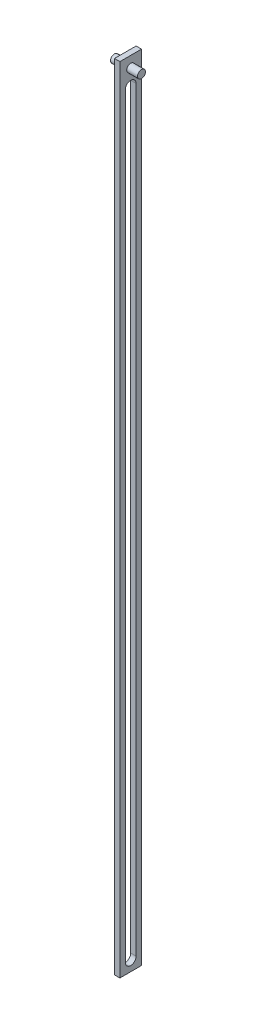
from build123d import *

# Parameters (mm, degrees)
SKETCH1_W                = 12.7
SKETCH1_H                = 457.2
BOSS_EXTRUDE1_DEPTH      = 3.175
SKETCH2_W                = 3.175
SKETCH2_H                = 12.7
BOSS_EXTRUDE2_DEPTH      = 9.525
BOSS_EXTRUDE3_DEPTH      = 6.35
BOSS_EXTRUDE3_DEPTH_BACK = 9.525
SKETCH3_R                = 2.337311212


with BuildPart() as part:
    # Sketch1 → Boss-Extrude1 (new body)
    with BuildSketch(Plane(origin=(0, 0, 0), x_dir=(0, 0, -1), z_dir=(1, 0, 0))):
        with Locations((-4.081130849, 198.273055815)):
            Rectangle(SKETCH1_W, SKETCH1_H)
        with BuildLine():
            Line((-7.256130849, -23.976944185), (-7.256130849, 420.523055815))
            ThreePointArc((-7.256130849, 420.523055815), (-4.081130849, 423.698055815), (-0.906130849, 420.523055815))
            Line((-0.906130849, 420.523055815), (-0.906130849, -23.976944185))
            ThreePointArc((-0.906130849, -23.976944185), (-4.081130849, -27.151944185), (-7.256130849, -23.976944185))
        make_face(mode=Mode.SUBTRACT)
    extrude(amount=BOSS_EXTRUDE1_DEPTH)

    # Sketch2 → Boss-Extrude2 (add)
    with BuildSketch(Plane(origin=(0, 426.873055815, 0), x_dir=(1, 0, 0), z_dir=(0, 1, 0))):
        with Locations((1.5875, -4.081130849)):
            Rectangle(SKETCH2_W, SKETCH2_H)
    extrude(amount=BOSS_EXTRUDE2_DEPTH)

    # Sketch3 → Boss-Extrude3 (add, two sides: drawn at the far end of the back side and taken through both)
    with BuildSketch(Plane(origin=(3.175, 0, 0), x_dir=(0, 0, -1), z_dir=(1, 0, 0)).offset(-BOSS_EXTRUDE3_DEPTH_BACK)):
        with Locations((-4.081130849, 430.048055815)):
            Circle(SKETCH3_R)
    extrude(amount=BOSS_EXTRUDE3_DEPTH + BOSS_EXTRUDE3_DEPTH_BACK)


solid = part.part
